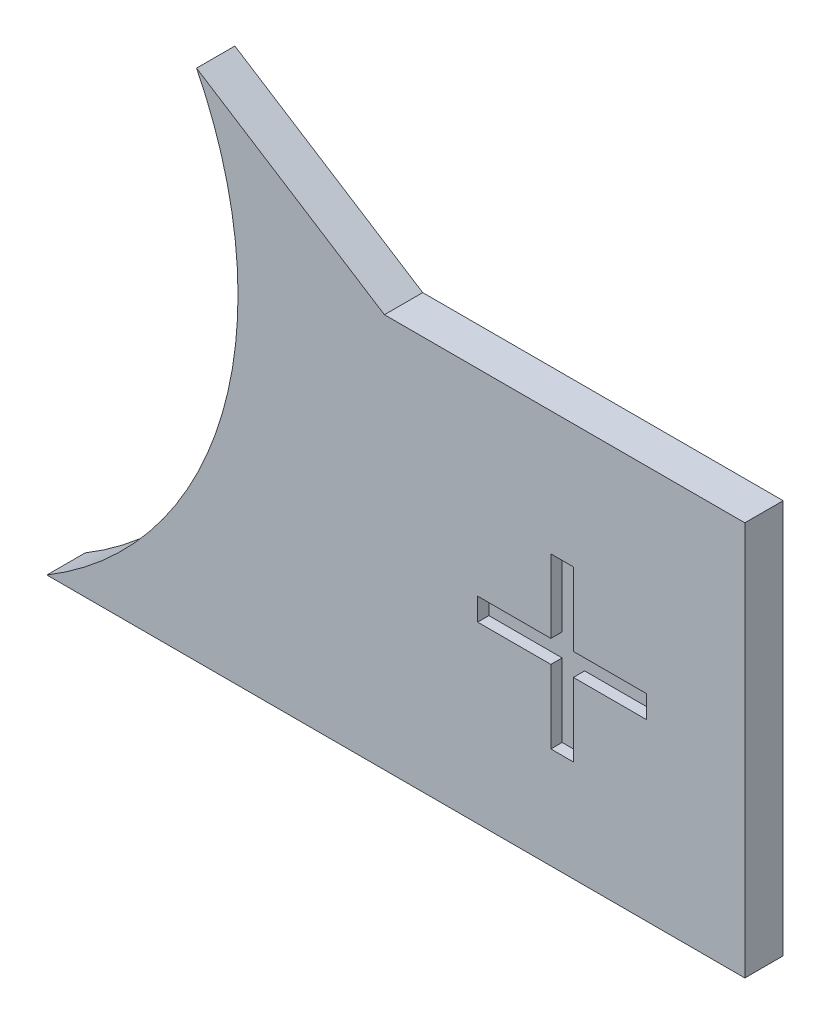
from build123d import *

# Parameters (mm, degrees)
BOSS_EXTRUDE1_DEPTH = 3.4
SKETCH3_R           = 5
CUT_EXTRUDE1_DEPTH  = 6
CUT_EXTRUDE2_DEPTH  = 10
SKETCH6_R           = 35
CUT_EXTRUDE3_DEPTH  = 10
CUT_EXTRUDE4_DEPTH  = 1


with BuildPart() as part:
    # Sketch1 → Boss-Extrude1 (new body)
    with BuildSketch(Plane.XY):
        with BuildLine():
            Line((0, -30), (80, -30))
            Line((80, -30), (80, 5))
            Line((80, 5), (48, 5))
            Line((48, 5), (16.114075804, 25.304872277))
            ThreePointArc((16.114075804, 25.304872277), (-28.802310396, 8.392074585), (0, -30))
        make_face()
    extrude(amount=BOSS_EXTRUDE1_DEPTH)

    # Sketch3 → Cut-Extrude1 (cut)
    with BuildSketch(Plane.XY.offset(3.4)):
        Circle(SKETCH3_R)
    extrude(amount=-CUT_EXTRUDE1_DEPTH, mode=Mode.SUBTRACT)

    # Sketch5 → Cut-Extrude2 (cut)
    with BuildSketch(Plane.XY.offset(3.4)):
        with BuildLine():
            ThreePointArc((0, 10), (-8.660254038, 5), (-8.660254038, -5))
            ThreePointArc((-8.660254038, -5), (-10.124355653, -10.464101615), (-15.588457268, -9))
            ThreePointArc((-15.588457268, -9), (-15.588457268, 9), (0, 18))
            ThreePointArc((0, 18), (4, 14), (0, 10))
        make_face()
    extrude(amount=-CUT_EXTRUDE2_DEPTH, mode=Mode.SUBTRACT)

    # Sketch6 → Cut-Extrude3 (cut)
    with BuildSketch(Plane(origin=(0, 0, 0), x_dir=(-1, 0, 0), z_dir=(0, 0, -1))):
        Circle(SKETCH6_R)
    extrude(amount=-CUT_EXTRUDE3_DEPTH, mode=Mode.SUBTRACT)

    # Sketch7 → Cut-Extrude4 (cut)
    with BuildSketch(Plane.XY.offset(3.4)):
        Polygon((62.77538264, -14.5), (62.77538264, -21), (64.77538264, -21), (64.77538264, -14.5), (71.27538264, -14.5), (71.27538264, -12.5), (64.77538264, -12.5), (64.77538264, -6), (62.77538264, -6), (62.77538264, -12.5), (56.27538264, -12.5), (56.27538264, -14.5), align=None)
    extrude(amount=-CUT_EXTRUDE4_DEPTH, mode=Mode.SUBTRACT)


solid = part.part
